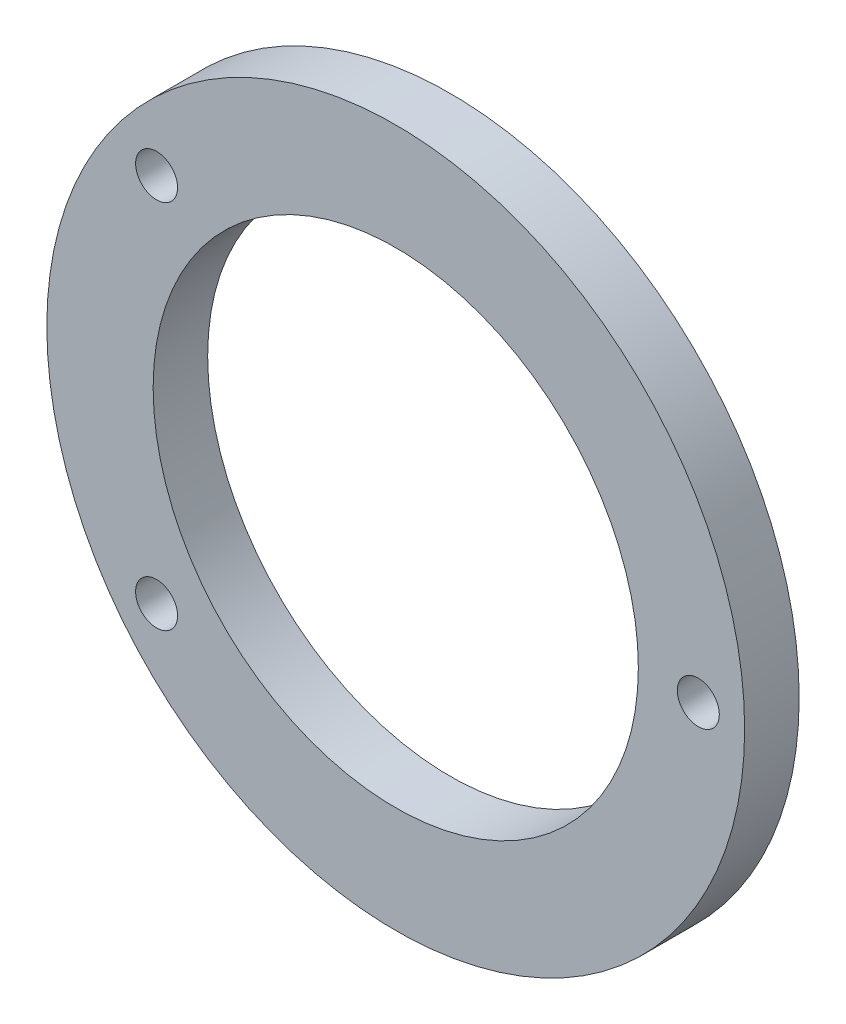
from build123d import *

# Parameters (mm, degrees)
ESQUISSE3_R        = 32
ESQUISSE3_R_2      = 22.25
ESQUISSE3_R_3      = 1.925
BOSS_EXTRU_1_DEPTH = 5


with BuildPart() as part:
    # Esquisse3 → Boss.-Extru.1 (new body)
    with BuildSketch(Plane.XY):
        Circle(ESQUISSE3_R)
        Circle(ESQUISSE3_R_2, mode=Mode.SUBTRACT)
        with Locations((27.75, 0)):
            Circle(ESQUISSE3_R_3, mode=Mode.SUBTRACT)
        with Locations((-21.933137031, 17)):
            Circle(ESQUISSE3_R_3, mode=Mode.SUBTRACT)
        with Locations((-21.933137031, -17)):
            Circle(ESQUISSE3_R_3, mode=Mode.SUBTRACT)
    extrude(amount=BOSS_EXTRU_1_DEPTH)


solid = part.part
